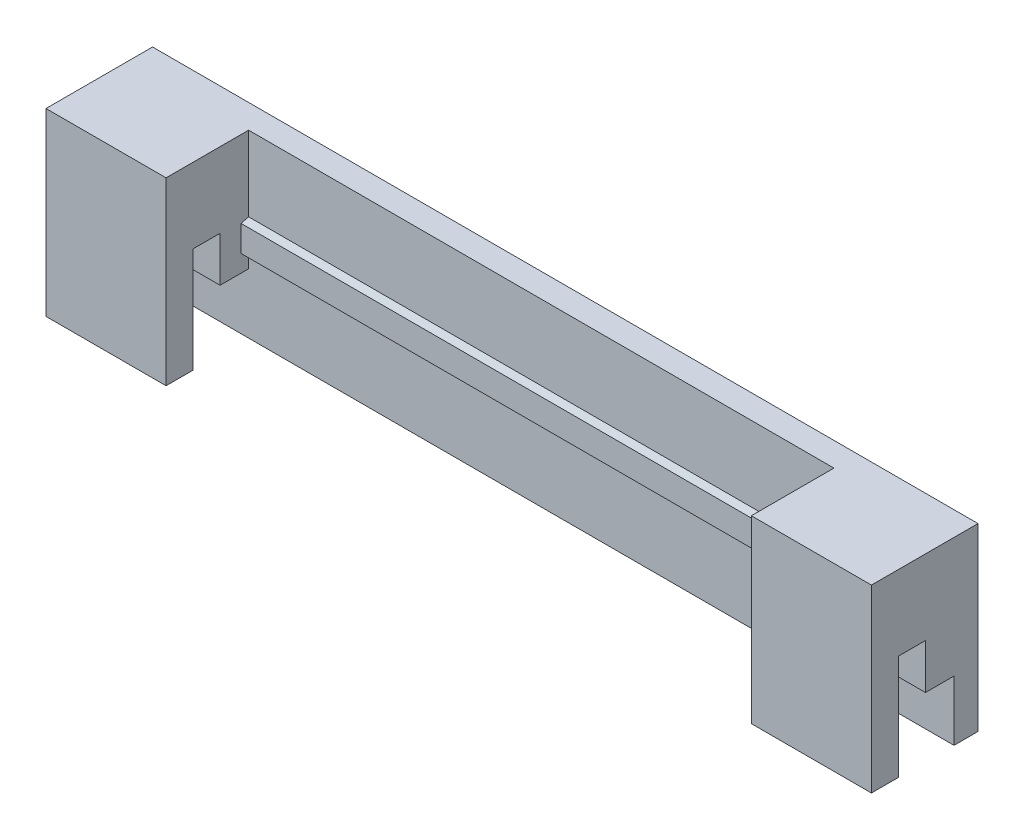
from build123d import *

# Parameters (mm, degrees)
SKETCH1_W           = 55
SKETCH1_H           = 12
BOSS_EXTRUDE1_DEPTH = 1.6
SKETCH2_W           = 8
SKETCH2_H           = 8
BOSS_EXTRUDE2_DEPTH = 1.9
SKETCH3_W           = 8
SKETCH3_H           = 5
BOSS_EXTRUDE3_DEPTH = 1.8
SKETCH4_W           = 8
SKETCH4_H           = 12
BOSS_EXTRUDE6_DEPTH = 1.8
SKETCH6_W           = 55
SKETCH6_H           = 2
BOSS_EXTRUDE7_DEPTH = 0.5
BOSS_EXTRUDE7_TAPER = 15


with BuildPart() as part:
    # Sketch1 → Boss-Extrude1 (new body)
    with BuildSketch(Plane.XY):
        Rectangle(SKETCH1_W, SKETCH1_H)
    extrude(amount=BOSS_EXTRUDE1_DEPTH)

    # Sketch2 → Boss-Extrude2 (add)
    with BuildSketch(Plane.XY.offset(1.6)):
        with Locations((-23.5, 2)):
            Rectangle(SKETCH2_W, SKETCH2_H)
        with Locations((23.5, 2)):
            Rectangle(SKETCH2_W, SKETCH2_H)
    extrude(amount=BOSS_EXTRUDE2_DEPTH)

    # Sketch3 → Boss-Extrude3 (add)
    with BuildSketch(Plane.XY.offset(3.5)):
        with Locations((-23.5, 3.5)):
            Rectangle(SKETCH3_W, SKETCH3_H)
        with Locations((23.5, 3.5)):
            Rectangle(SKETCH3_W, SKETCH3_H)
    extrude(amount=BOSS_EXTRUDE3_DEPTH)

    # Sketch4 → Boss-Extrude6 (add)
    with BuildSketch(Plane.XY.offset(5.3)):
        with Locations((-23.5, 0)):
            Rectangle(SKETCH4_W, SKETCH4_H)
        with Locations((23.5, 0)):
            Rectangle(SKETCH4_W, SKETCH4_H)
    extrude(amount=BOSS_EXTRUDE6_DEPTH)

    # Sketch6 → Boss-Extrude7 (add)
    with BuildSketch(Plane.XY.offset(1.6)):
        Rectangle(SKETCH6_W, SKETCH6_H)
    extrude(amount=BOSS_EXTRUDE7_DEPTH, taper=BOSS_EXTRUDE7_TAPER)


solid = part.part
